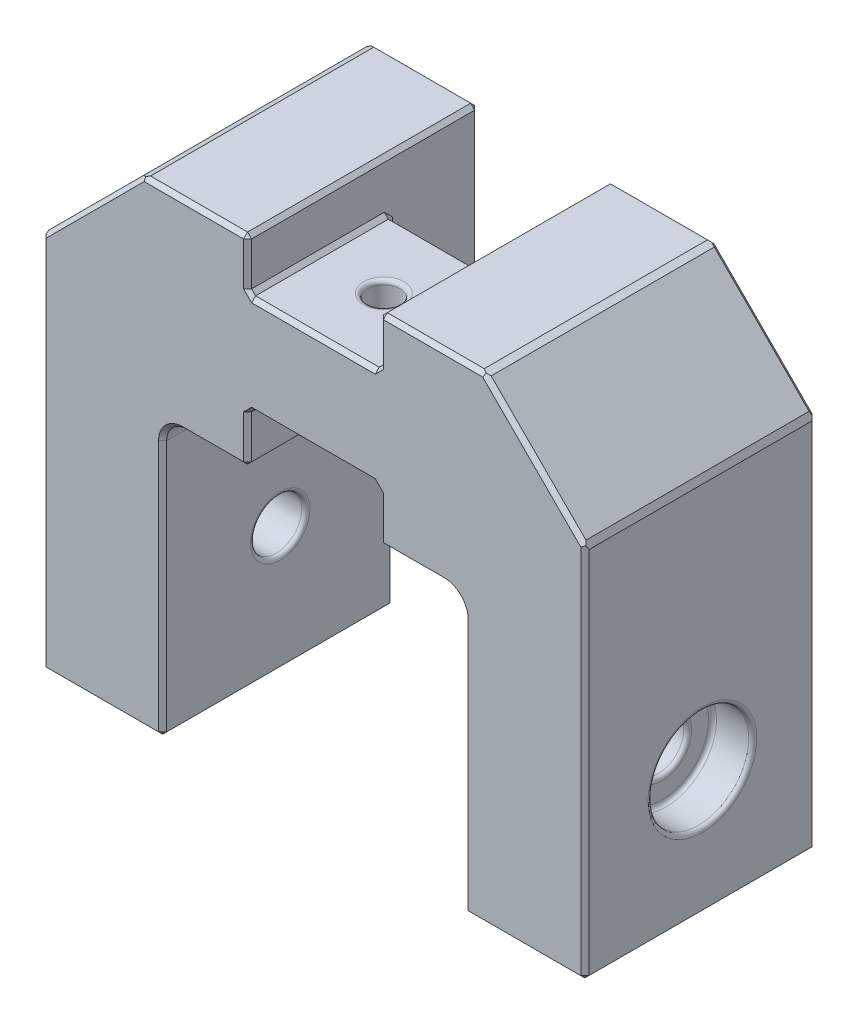
from build123d import *

# Parameters (mm, degrees)
SKETCH1_W           = 13.1
SKETCH1_H           = 9.8
BOSS_EXTRUDE1_DEPTH = 23
SKETCH1_4_W         = 13.1
SKETCH1_4_H         = 9.8
CUT_EXTRUDE1_DEPTH  = 9
CHAMFER4_SIZE       = 10
CHAMFER5_SIZE       = 0.4
CHAMFER6_SIZE       = 0.4
SKETCH2_R           = 2.55
CUT_EXTRUDE2_DEPTH  = 69.337398253
SKETCH2_4_R         = 5
SKETCH2_4_R_2       = 2.55
CUT_EXTRUDE3_DEPTH  = 4
CUT_EXTRUDE4_START  = -4
SKETCH5_R           = 5
SKETCH5_R_2         = 2.55
CUT_EXTRUDE4_DEPTH  = 4
FILLET1_R           = 0.4
SKETCH6_R           = 1.6
CUT_EXTRUDE5_DEPTH  = 56.278929078
FILLET2_R           = 0.4


with BuildPart() as part:
    # Sketch1 → Boss-Extrude1 (new body)
    with BuildSketch(Plane.XY):
        with BuildLine():
            Line((6.55, 20.1), (6.55, 15))
            Line((6.55, 15), (13, 15))
            ThreePointArc((13, 15), (14.414213562, 14.414213562), (15, 13))
            Line((15, 13), (15, -12.5))
            Line((15, -12.5), (27, -12.5))
            Line((27, -12.5), (27, 35))
            Line((27, 35), (6.55, 35))
            Line((6.55, 35), (6.55, 29.9))
            Line((6.55, 29.9), (6.55, 20.1))
        make_face()
        with BuildLine():
            Line((-27, -12.5), (-15, -12.5))
            Line((-15, -12.5), (-15, 13))
            ThreePointArc((-15, 13), (-14.414213562, 14.414213562), (-13, 15))
            Line((-13, 15), (-6.55, 15))
            Line((-6.55, 15), (-6.55, 20.1))
            Line((-6.55, 20.1), (-6.55, 29.9))
            Line((-6.55, 29.9), (-6.55, 35))
            Line((-6.55, 35), (-27, 35))
            Line((-27, 35), (-27, -12.5))
        make_face()
        with Locations((0, 25)):
            Rectangle(SKETCH1_W, SKETCH1_H)
    extrude(amount=BOSS_EXTRUDE1_DEPTH)

    # Sketch1<4> → Cut-Extrude1 (cut)
    with BuildSketch(Plane.XY):
        with Locations((0, 25)):
            Rectangle(SKETCH1_4_W, SKETCH1_4_H)
    extrude(amount=CUT_EXTRUDE1_DEPTH, mode=Mode.SUBTRACT)

    # Chamfer4
    chamfer4_edges = [part.edges().sort_by_distance(p)[0] for p in [
        (-27, 35, 11.5),
        (27, 35, 11.5),
    ]]
    chamfer(chamfer4_edges, length=CHAMFER4_SIZE)

    # Chamfer5
    chamfer5_edges = [part.edges().sort_by_distance(p)[0] for p in [
        (15, 0.25, 23),
        (21, -12.5, 23),
        (27, 6.25, 23),
        (9.775, 15, 0),
        (6.55, 25, 0),
        (-6.55, 25, 0),
        (-9.775, 15, 0),
        (-14.414213562, 14.414213562, 0),
        (-15, 0.25, 0),
        (-21, -12.5, 0),
        (-11.775, 35, 0),
        (27, 6.25, 0),
        (21, -12.5, 0),
        (15, 0.25, 0),
        (14.414213562, 14.414213562, 0),
        (6.55, 32.45, 23),
        (6.55, 15, 11.5),
        (6.55, 20.1, 16),
        (-6.55, 20.1, 16),
        (-6.55, 15, 11.5),
        (-15, -12.5, 11.5),
        (-27, -12.5, 11.5),
        (-6.55, 35, 11.5),
        (-6.55, 29.9, 16),
        (6.55, 29.9, 16),
        (6.55, 35, 11.5),
        (27, -12.5, 11.5),
        (15, -12.5, 11.5),
        (0, 29.9, 23),
        (-6.55, 32.45, 23),
        (-11.775, 35, 23),
        (14.414213562, 14.414213562, 23),
        (-21, -12.5, 23),
        (0, 29.9, 9),
        (6.55, 25, 9),
        (-6.55, 25, 9),
        (0, 20.1, 9),
        (-15, 0.25, 23),
        (-14.414213562, 14.414213562, 23),
        (11.775, 35, 0),
        (11.775, 35, 23),
        (-9.775, 15, 23),
        (22, 30, 0),
        (-27, 6.25, 23),
        (-22, 30, 23),
        (22, 30, 23),
        (-27, 6.25, 0),
        (-6.55, 17.55, 23),
        (-22, 30, 0),
        (0, 20.1, 23),
        (6.55, 17.55, 23),
        (9.775, 15, 23),
    ]]
    chamfer(chamfer5_edges, length=CHAMFER5_SIZE)

    # Chamfer6
    chamfer6_edges = [part.edges().sort_by_distance(p)[0] for p in [
        (-27, 25, 11.5),
        (27, 25, 11.5),
        (-17, 35, 11.5),
        (17, 35, 11.5),
    ]]
    chamfer(chamfer6_edges, length=CHAMFER6_SIZE)

    # Sketch2 → Cut-Extrude2 (cut, through all)
    with BuildSketch(Plane(origin=(27, 0, 0), x_dir=(0, 0, -1), z_dir=(1, 0, 0))):
        with Locations(Location((-11.3, 0, 0), (0, 0, 90))):
            Circle(SKETCH2_R)
    extrude(amount=-CUT_EXTRUDE2_DEPTH, mode=Mode.SUBTRACT)

    # Sketch2<4> → Cut-Extrude3 (cut)
    with BuildSketch(Plane(origin=(27, 0, 0), x_dir=(0, 0, -1), z_dir=(1, 0, 0))):
        with Locations(Location((-11.3, 0, 0), (0, 0, 90))):
            Circle(SKETCH2_4_R)
        with Locations(Location((-11.3, 0, 0), (0, 0, 90))):
            Circle(SKETCH2_4_R_2, mode=Mode.SUBTRACT)
    extrude(amount=-CUT_EXTRUDE3_DEPTH, mode=Mode.SUBTRACT)

    # Sketch5 → Cut-Extrude4 (cut)
    with BuildSketch(Plane.ZY.offset(27).offset(CUT_EXTRUDE4_START)):
        with Locations(Location((11.3, 0, 0), (0, 0, 90))):
            Circle(SKETCH5_R)
        with Locations(Location((11.3, 0, 0), (0, 0, 270))):
            Circle(SKETCH5_R_2, mode=Mode.SUBTRACT)
    extrude(amount=CUT_EXTRUDE4_DEPTH, mode=Mode.SUBTRACT)

    # Fillet1
    fillet1_edges = [part.edges().sort_by_distance(p)[0] for p in [
        (27, -5, 11.3),
        (-27, -5, 11.3),
    ]]
    fillet(fillet1_edges, radius=FILLET1_R)

    # Sketch6 → Cut-Extrude5 (cut, through all)
    with BuildSketch(Plane(origin=(0, 29.9, 0), x_dir=(1, 0, 0), z_dir=(0, 1, 0))):
        with Locations(Location((0, -16, 0), (0, 0, 270))):
            Circle(SKETCH6_R)
    extrude(amount=-CUT_EXTRUDE5_DEPTH, mode=Mode.SUBTRACT)

    # Fillet2
    fillet2_edges = [part.edges().sort_by_distance(p)[0] for p in [
        (15, -2.55, 11.3),
        (-15, -2.55, 11.3),
        (23, -5, 11.3),
        (23, -2.55, 11.3),
        (-23, -2.55, 11.3),
        (-23, -5, 11.3),
        (0, 20.1, 14.4),
        (0, 29.9, 14.4),
    ]]
    fillet(fillet2_edges, radius=FILLET2_R)


solid = part.part
